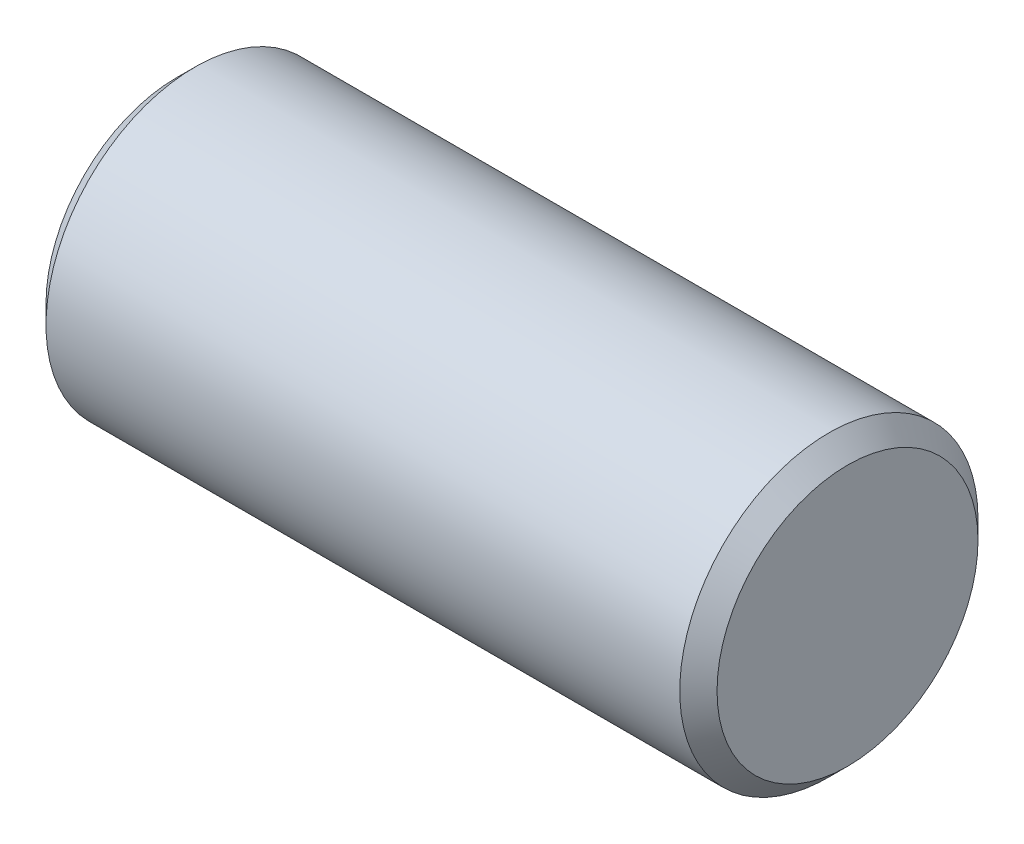
from build123d import *

# Parameters (mm, degrees)
SCHIZZO2_R                   = 4
ESTRUSIONE_ESTRUSIONE2_DEPTH = 18
SMUSSO2_SIZE                 = 0.5


with BuildPart() as part:
    # Schizzo2 → Estrusione-Estrusione2 (new body)
    with BuildSketch(Plane(origin=(0, 0, 0), x_dir=(0, 0, -1), z_dir=(1, 0, 0))):
        Circle(SCHIZZO2_R)
    extrude(amount=ESTRUSIONE_ESTRUSIONE2_DEPTH)

    # Smusso2
    smusso2_edges = [part.edges().sort_by_distance(p)[0] for p in [
        (0, 0, 4),
        (18, 0, 4),
    ]]
    chamfer(smusso2_edges, length=SMUSSO2_SIZE)


solid = part.part
